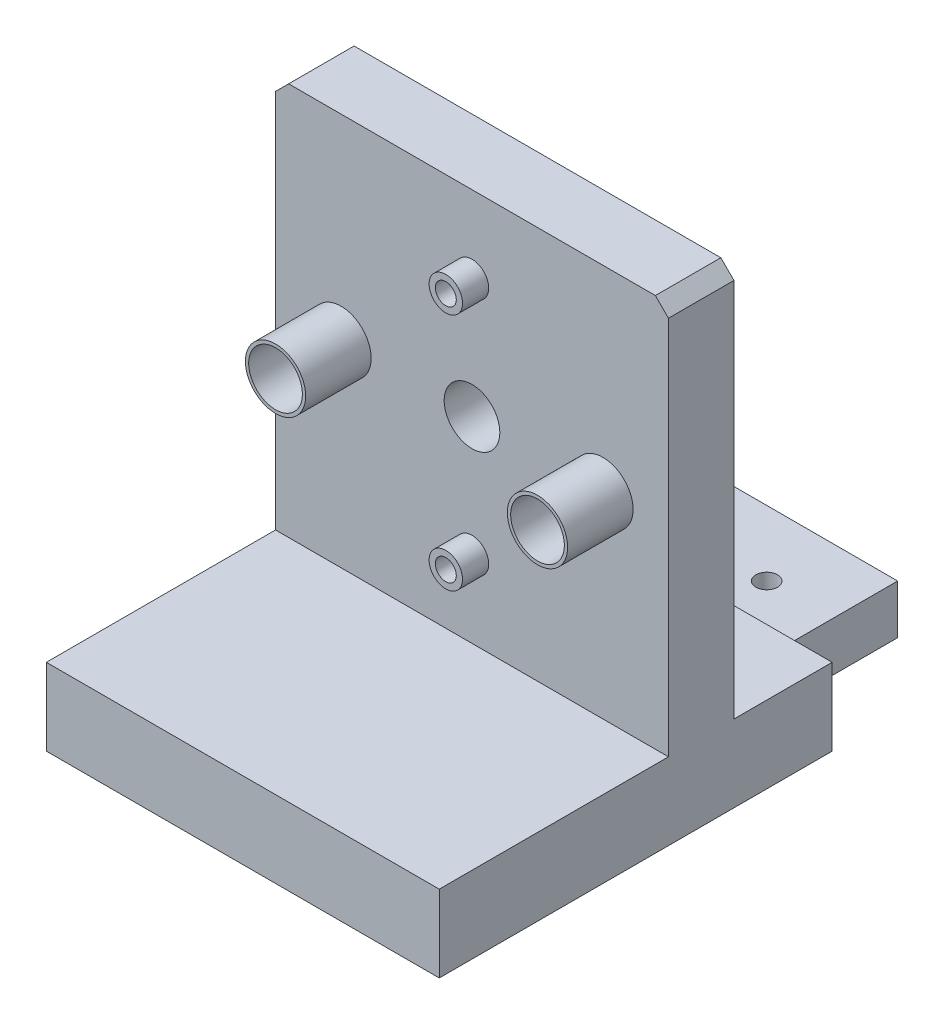
from build123d import *

# Parameters (mm, degrees)
SKETCH_1_W                = 60
SKETCH_1_H                = 60
EXTRUDE_1_DEPTH           = 10
HOLE_WIZARD_1_D           = 8.5
HOLE_WIZARD_1_DEPTH       = 20
HOLE_WIZARD_2_D           = 8
HOLE_WIZARD_2_CSINK_D     = 8.2
HOLE_WIZARD_2_CSINK_ANGLE = 45
HOLE_WIZARD_3_D           = 3.2
SKETCH_8_R                = 4.6
SKETCH_8_R_2              = 4.1
EXTRUDE_2_DEPTH           = 10
EXTRUDE_START             = 4
SKETCH_10_R               = 2.55
SKETCH_10_R_2             = 1.6
EXTRUDE_4_DEPTH           = 4
SKETCH_11_W               = 60
SKETCH_11_H               = 80
EXTRUDE_5_DEPTH           = 11.75
SKETCH_12_W               = 10
SKETCH_12_H               = 20
CUT_EXTRUDE_3_DEPTH       = 90.850222593
SKETCH_13_W               = 40
SKETCH_13_H               = 20
CUT_EXTRUDE_4_DEPTH       = 4.25
HOLE_WIZARD_4_D           = 3.3
CHAMFER_1_SIZE            = 2


with BuildPart() as part:
    # 草图1 → 凸台-拉伸1 (new body)
    with BuildSketch(Plane.XY):
        Rectangle(SKETCH_1_W, SKETCH_1_H)
    extrude(amount=EXTRUDE_1_DEPTH)

    # 孔1
    with Locations(Plane.XY.offset(10)):
        with Locations((0, 0)):
            Hole(HOLE_WIZARD_1_D / 2, depth=HOLE_WIZARD_1_DEPTH)

    # 孔2 (through all)
    with Locations(Plane.XY.offset(10)):
        with Locations((20, 0), (-20, 0)):
            CounterSinkHole(HOLE_WIZARD_2_D / 2, HOLE_WIZARD_2_CSINK_D / 2, counter_sink_angle=HOLE_WIZARD_2_CSINK_ANGLE)

    # 孔3 (through all)
    with Locations(Plane(origin=(0, 0, 0), x_dir=(-1, 0, 0), z_dir=(0, 0, -1))):
        with Locations((0, 18.25), (0, -18.25)):
            Hole(HOLE_WIZARD_3_D / 2)

    # 草图8 → 凸台-拉伸2 (add)
    with BuildSketch(Plane.XY.offset(10)):
        with Locations(Location((-20, 0, 0), (0, 0, 180))):
            Circle(SKETCH_8_R)
        with Locations((-20, 0)):
            Circle(SKETCH_8_R_2, mode=Mode.SUBTRACT)
    extrude_2 = extrude(amount=EXTRUDE_2_DEPTH)

    # 镜向1: 凸台-拉伸2 across plane
    add(extrude_2.mirror(Plane(origin=(0, 0, 0), x_dir=(0, 0, 1), z_dir=(1, 0, 0))))

    # 草图10 → 凸台-拉伸4 (add)
    with BuildSketch(Plane.XY.offset(10).offset(EXTRUDE_START)):
        with Locations(Location((0, 18.25, 0), (0, 0, 180))):
            Circle(SKETCH_10_R)
        with Locations(Location((0, 18.25, 0), (0, 0, 180))):
            Circle(SKETCH_10_R_2, mode=Mode.SUBTRACT)
    extrude_4 = extrude(amount=-EXTRUDE_4_DEPTH)

    # 镜向4: 凸台-拉伸4 across plane
    add(extrude_4.mirror(Plane.ZX))

    # 草图11 → 凸台-拉伸5 (add)
    with BuildSketch(Plane.XZ.offset(30)):
        with Locations((0, 5)):
            Rectangle(SKETCH_11_W, SKETCH_11_H)
    extrude(amount=EXTRUDE_5_DEPTH)

    # 草图12 → 切除-拉伸3 (cut, through all)
    with BuildSketch(Plane.XZ.offset(41.75)):
        with Locations((-25, -25)):
            Rectangle(SKETCH_12_W, SKETCH_12_H)
        with Locations((25, -25)):
            Rectangle(SKETCH_12_W, SKETCH_12_H)
    extrude(amount=-CUT_EXTRUDE_3_DEPTH, mode=Mode.SUBTRACT)

    # 草图13 → 切除-拉伸4 (cut)
    with BuildSketch(Plane(origin=(0, -30, 0), x_dir=(1, 0, 0), z_dir=(0, 1, 0))):
        with Locations((0, 25)):
            Rectangle(SKETCH_13_W, SKETCH_13_H)
    extrude(amount=-CUT_EXTRUDE_4_DEPTH, mode=Mode.SUBTRACT)

    # 孔4 (through all)
    with Locations(Plane(origin=(0, -41.75, 0), x_dir=(-1, 0, 0), z_dir=(0, -1, 0))):
        with Locations((-10, 25), (10, 25)):
            Hole(HOLE_WIZARD_4_D / 2)

    # 倒角1
    chamfer_1_edges = [part.edges().sort_by_distance(p)[0] for p in [
        (-30, 30, 5),
        (30, 30, 5),
    ]]
    chamfer(chamfer_1_edges, length=CHAMFER_1_SIZE)


solid = part.part
